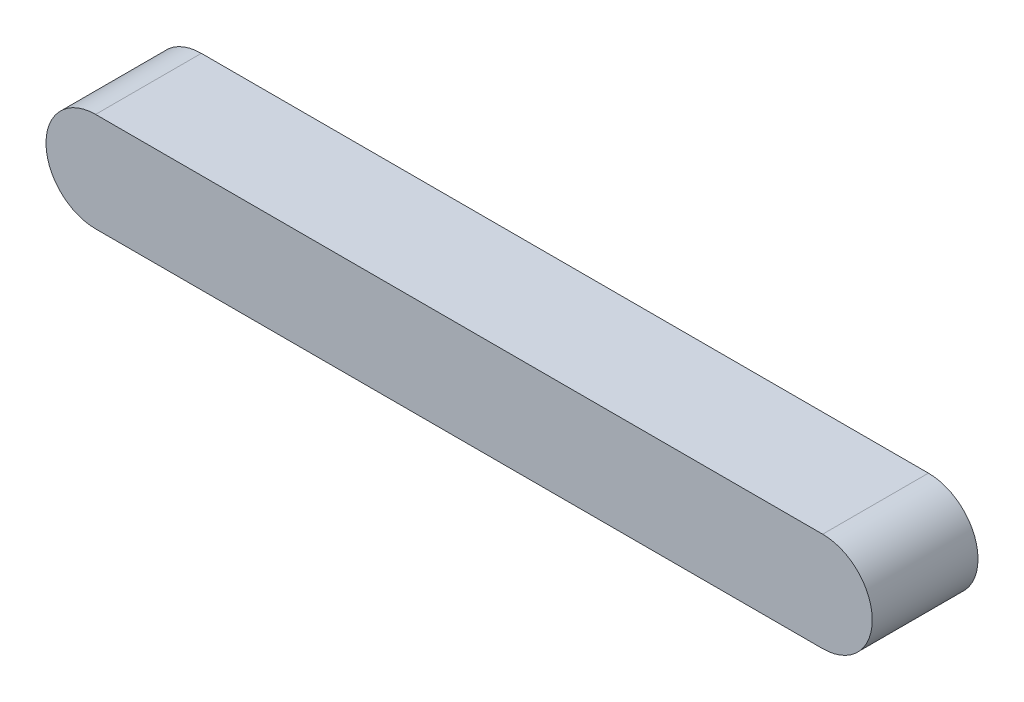
from build123d import *

# Parameters (mm, degrees)
ESTRUSIONE_ESTRUSIONE1_DEPTH = 3.2


with BuildPart() as part:
    # Schizzo1 → Estrusione-Estrusione1 (new body)
    with BuildSketch(Plane.XY):
        with BuildLine():
            Line((0, 1.5), (22, 1.5))
            ThreePointArc((22, 1.5), (23.5, 0), (22, -1.5))
            Line((22, -1.5), (0, -1.5))
            ThreePointArc((0, -1.5), (-1.5, 0), (0, 1.5))
        make_face()
    extrude(amount=ESTRUSIONE_ESTRUSIONE1_DEPTH)


solid = part.part
